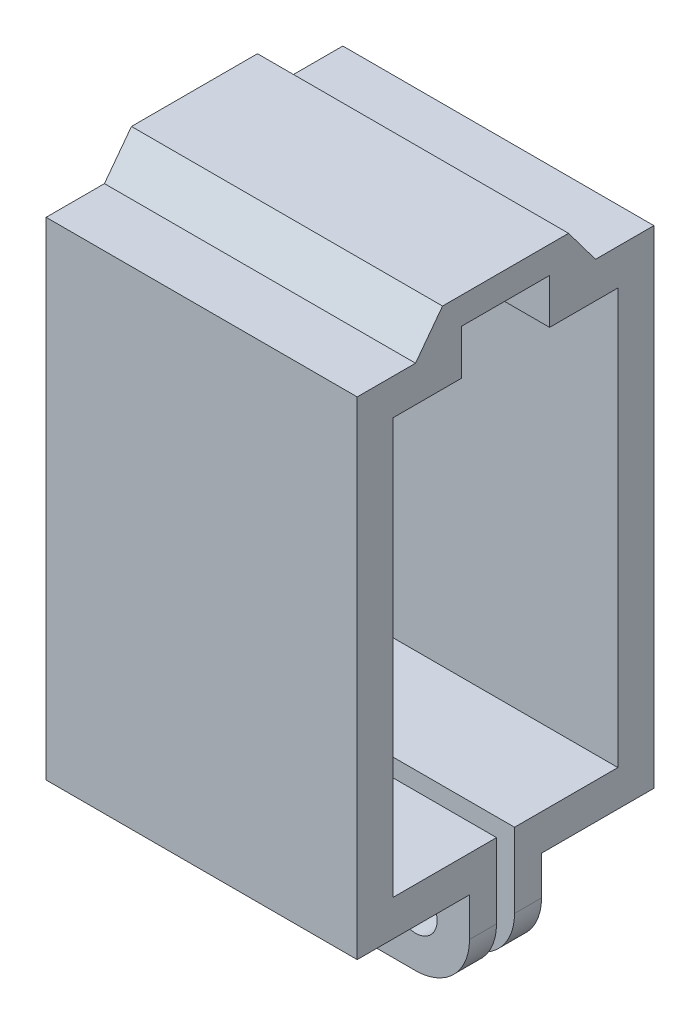
from build123d import *

# Parameters (mm, degrees)
SKETCH1_W            = 16.48
SKETCH1_H            = 27.0711
SKETCH1_W_2          = 12.48
SKETCH1_H_2          = 23.0711
BOSS_EXTRUDE1_DEPTH  = 17.2796
BOSS_EXTRUDE2_DEPTH  = 17.2796
SKETCH3_W            = 4.8956
SKETCH3_H            = 3.65
CUT_EXTRUDE1_DEPTH   = 27.853165612
SKETCH4_W            = 4
SKETCH4_H            = 5.15
BOSS_EXTRUDE3_DEPTH  = 17.2796
FILLET1_R            = 3
SKETCH5_W            = 1
SKETCH5_H            = 7.15
CUT_EXTRUDE3_DEPTH   = 31.685099533
M2_CLEARANCE_HOLE1_D = 2.4


with BuildPart() as part:
    # Sketch1 → Boss-Extrude1 (new body)
    with BuildSketch(Plane(origin=(0, 0, 0), x_dir=(0, 0, -1), z_dir=(1, 0, 0))):
        with Locations((0, -5.29555)):
            Rectangle(SKETCH1_W, SKETCH1_H)
        with Locations((0, -5.29555)):
            Rectangle(SKETCH1_W_2, SKETCH1_H_2, mode=Mode.SUBTRACT)
    extrude(amount=BOSS_EXTRUDE1_DEPTH)

    # Sketch2 → Boss-Extrude2 (add)
    with BuildSketch(Plane(origin=(17.2796, 0, 0), x_dir=(0, 0, -1), z_dir=(1, 0, 0))):
        Polygon((-5, 8.24), (5, 8.24), (3.5, 10.24), (-3.5, 10.24), align=None)
    extrude(amount=-BOSS_EXTRUDE2_DEPTH)

    # Sketch3 → Cut-Extrude1 (cut, through all)
    with BuildSketch(Plane(origin=(17.2796, 0, 0), x_dir=(0, 0, -1), z_dir=(1, 0, 0))):
        with Locations((0, 6.915)):
            Rectangle(SKETCH3_W, SKETCH3_H)
    extrude(amount=-CUT_EXTRUDE1_DEPTH, mode=Mode.SUBTRACT)

    # Sketch4 → Boss-Extrude3 (add)
    with BuildSketch(Plane(origin=(17.2796, 0, 0), x_dir=(0, 0, -1), z_dir=(1, 0, 0))):
        with Locations((0, -21.4061)):
            Rectangle(SKETCH4_W, SKETCH4_H)
    extrude(amount=-BOSS_EXTRUDE3_DEPTH)

    # Fillet1
    fillet1_edges = [part.edges().sort_by_distance(p)[0] for p in [
        (17.2796, -23.9811, 0),
        (0, -23.9811, 0),
    ]]
    fillet(fillet1_edges, radius=FILLET1_R)

    # Sketch5 → Cut-Extrude3 (cut, through all)
    with BuildSketch(Plane(origin=(17.2796, 0, 0), x_dir=(0, 0, -1), z_dir=(1, 0, 0))):
        with Locations((0, -20.4061)):
            Rectangle(SKETCH5_W, SKETCH5_H)
    extrude(amount=-CUT_EXTRUDE3_DEPTH, mode=Mode.SUBTRACT)

    # M2 Clearance Hole1 (through all)
    with Locations(Plane(origin=(0, 0, -2), x_dir=(-1, 0, 0), z_dir=(0, 0, -1))):
        with Locations((-14.2796, -20.9811), (-3, -20.9811)):
            Hole(M2_CLEARANCE_HOLE1_D / 2)


solid = part.part
